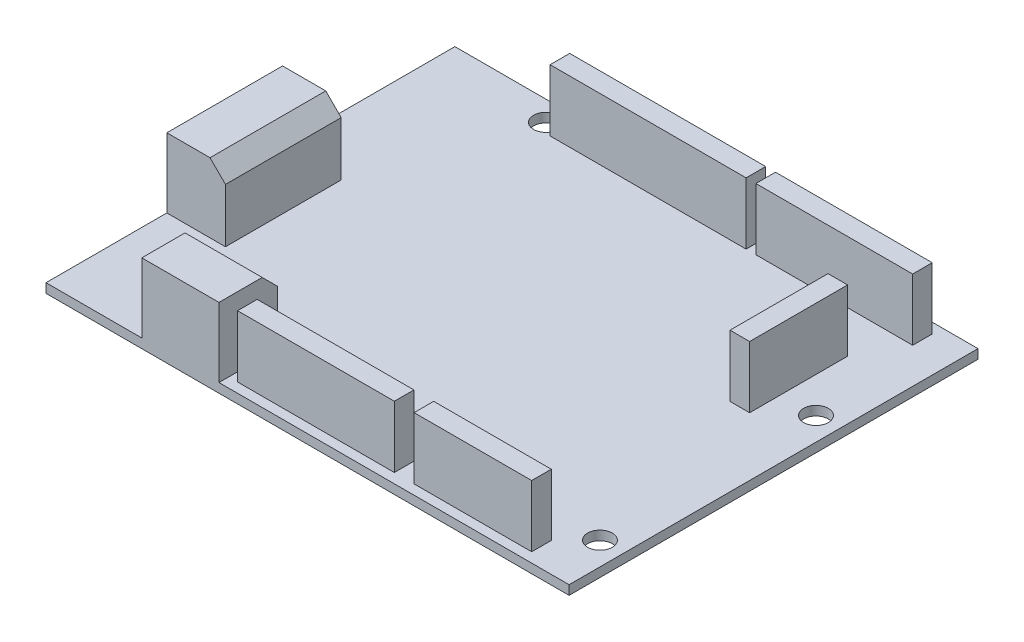
from build123d import *

# Parameters (mm, degrees)
SKETCH_1_W      = 67.8
SKETCH_1_H      = 53
SKETCH_1_R      = 1.6
EXTRUDE_1_DEPTH = 1.2
SKETCH_2_W      = 25.4
SKETCH_2_H      = 2.54
SKETCH_2_W_2    = 20.32
SKETCH_2_W_3    = 15.24
SKETCH_2_W_4    = 2.54
SKETCH_2_H_2    = 12.7
EXTRUDE_2_DEPTH = 8
SKETCH_3_W      = 7.6
SKETCH_3_H      = 15
SKETCH_3_W_2    = 10
SKETCH_3_H_2    = 7.6
EXTRUDE_3_DEPTH = 9
CHAMFER_1_SIZE  = 2


with BuildPart() as part:
    # 草图1 → 凸台-拉伸1 (new body)
    with BuildSketch(Plane(origin=(0, 0, 0), x_dir=(1, 0, 0), z_dir=(0, 1, 0))):
        with Locations((33.9, 26.5)):
            Rectangle(SKETCH_1_W, SKETCH_1_H)
        with Locations(Location((64.8, 35, 0), (0, 0, 270))):
            Circle(SKETCH_1_R, mode=Mode.SUBTRACT)
        with Locations(Location((64.8, 7, 0), (0, 0, 270))):
            Circle(SKETCH_1_R, mode=Mode.SUBTRACT)
        with Locations(Location((14.4, 50.4, 0), (0, 0, 270))):
            Circle(SKETCH_1_R, mode=Mode.SUBTRACT)
    extrude(amount=EXTRUDE_1_DEPTH)

    # 草图2 → 凸台-拉伸2 (add)
    with BuildSketch(Plane(origin=(0, 1.2, 0), x_dir=(1, 0, 0), z_dir=(0, 1, 0))):
        with Locations((28.9, 50.41)):
            Rectangle(SKETCH_2_W, SKETCH_2_H)
        with Locations((53.03, 50.41)):
            Rectangle(SKETCH_2_W_2, SKETCH_2_H)
        with Locations((33.72, 2.54)):
            Rectangle(SKETCH_2_W_2, SKETCH_2_H)
        with Locations((54.06, 2.54)):
            Rectangle(SKETCH_2_W_3, SKETCH_2_H)
        with Locations((58.93, 37.35)):
            Rectangle(SKETCH_2_W_4, SKETCH_2_H_2)
    extrude(amount=EXTRUDE_2_DEPTH)

    # 草图3 → 凸台-拉伸3 (add)
    with BuildSketch(Plane(origin=(0, 1.2, 0), x_dir=(1, 0, 0), z_dir=(0, 1, 0))):
        with Locations((3.8, 23.16)):
            Rectangle(SKETCH_3_W, SKETCH_3_H)
        with Locations((17.42, 3.8)):
            Rectangle(SKETCH_3_W_2, SKETCH_3_H_2)
    extrude(amount=EXTRUDE_3_DEPTH)

    # 倒角1
    chamfer_1_edges = [part.edges().sort_by_distance(p)[0] for p in [
        (17.42, 10.2, -7.6),
        (7.6, 10.2, -23.16),
    ]]
    chamfer(chamfer_1_edges, length=CHAMFER_1_SIZE)


solid = part.part
